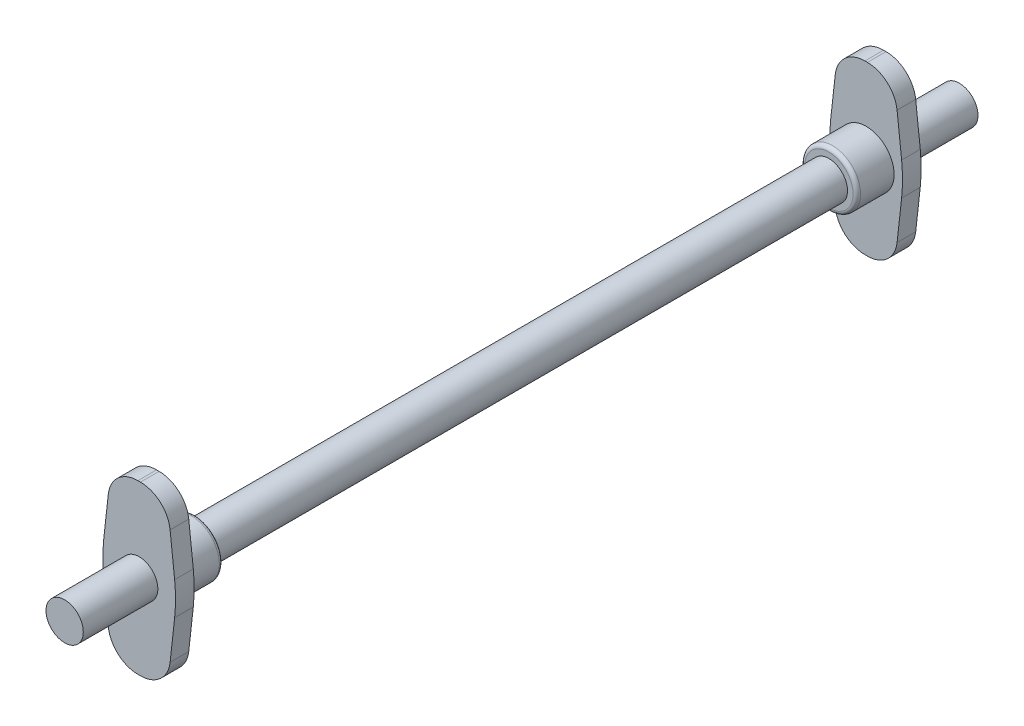
from build123d import *

# Parameters (mm, degrees)
SKETCH1_R           = 3.175
BOSS_EXTRUDE1_DEPTH = 53.975
SKETCH2_R           = 4.7625
BOSS_EXTRUDE2_DEPTH = 6.35
BOSS_EXTRUDE3_DEPTH = 3.175
FILLET1_R           = 0.635
BOSS_EXTRUDE4_START = 12.7
SKETCH4_R           = 3.175
BOSS_EXTRUDE4_DEPTH = 12.7


with BuildPart() as part:
    # Sketch1 → Boss-Extrude1 (new body)
    with BuildSketch(Plane.XY):
        Circle(SKETCH1_R)
    boss_extrude1 = extrude(amount=BOSS_EXTRUDE1_DEPTH)

    # Sketch2 → Boss-Extrude2 (add)
    with BuildSketch(Plane.XY.offset(53.975)):
        Circle(SKETCH2_R)
    boss_extrude2 = extrude(amount=BOSS_EXTRUDE2_DEPTH)

    # Sketch3 → Boss-Extrude3 (add)
    with BuildSketch(Plane.XY.offset(60.325)):
        with BuildLine():
            Line((-0.215682611, 14.2875), (0.215682611, 14.2875))
            ThreePointArc((0.215682611, 14.2875), (3.60364364, 12.992750331), (5.264611983, 9.768492152))
            Line((5.264611983, 9.768492152), (6.038337693, 2.804960762))
            ThreePointArc((6.038337693, 2.804960762), (6.193690832, 0), (6.038337693, -2.804960762))
            Line((6.038337693, -2.804960762), (5.264611983, -9.768492152))
            ThreePointArc((5.264611983, -9.768492152), (3.60364364, -12.992750331), (0.215682611, -14.2875))
            Line((0.215682611, -14.2875), (-0.215682611, -14.2875))
            ThreePointArc((-0.215682611, -14.2875), (-3.60364364, -12.992750331), (-5.264611983, -9.768492152))
            Line((-5.264611983, -9.768492152), (-6.038337693, -2.804960762))
            ThreePointArc((-6.038337693, -2.804960762), (-6.193690832, 0), (-6.038337693, 2.804960762))
            Line((-6.038337693, 2.804960762), (-5.264611983, 9.768492152))
            ThreePointArc((-5.264611983, 9.768492152), (-3.60364364, 12.992750331), (-0.215682611, 14.2875))
        make_face()
    boss_extrude3 = extrude(amount=BOSS_EXTRUDE3_DEPTH)

    # Mirror1: Boss-Extrude1, Boss-Extrude2, Boss-Extrude3 across plane
    add(boss_extrude1.mirror(Plane.XY))
    add(boss_extrude2.mirror(Plane.XY))
    add(boss_extrude3.mirror(Plane.XY))

    # Fillet1
    fillet1_edges = [part.edges().sort_by_distance(p)[0] for p in [
        (-4.7625, 0, -53.975),
        (-4.7625, 0, 53.975),
    ]]
    fillet(fillet1_edges, radius=FILLET1_R)

    # Sketch4 → Boss-Extrude4 (add)
    with BuildSketch(Plane.XY.offset(63.5).offset(BOSS_EXTRUDE4_START)):
        Circle(SKETCH4_R)
    boss_extrude4 = extrude(amount=-BOSS_EXTRUDE4_DEPTH)

    # Mirror2: Boss-Extrude4 across plane
    add(boss_extrude4.mirror(Plane.XY))


solid = part.part
